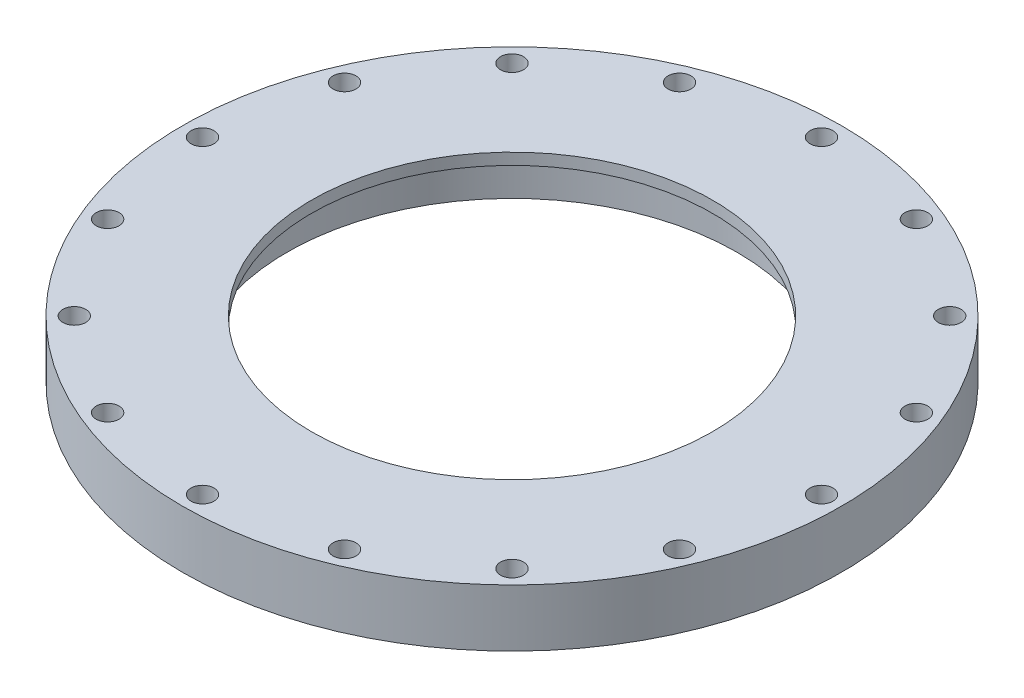
from build123d import *

# Parameters (mm, degrees)
SKETCH1_R           = 57.5
SKETCH1_R_2         = 39.25
BOSS_EXTRUDE1_DEPTH = 8
SKETCH3_R           = 57.5
SKETCH3_R_2         = 35
BOSS_EXTRUDE2_DEPTH = 2
SKETCH2_R           = 2
CUT_EXTRUDE1_DEPTH  = 25


with BuildPart() as part:
    # Sketch1 → Boss-Extrude1 (new body)
    with BuildSketch(Plane(origin=(0, 0, 0), x_dir=(1, 0, 0), z_dir=(0, 1, 0))):
        with Locations(Location((0, 0, 0), (0, 0, 270))):
            Circle(SKETCH1_R)
        with Locations(Location((0, 0, 0), (0, 0, 270))):
            Circle(SKETCH1_R_2, mode=Mode.SUBTRACT)
    extrude(amount=BOSS_EXTRUDE1_DEPTH)

    # Sketch3 → Boss-Extrude2 (add)
    with BuildSketch(Plane(origin=(0, 8, 0), x_dir=(1, 0, 0), z_dir=(0, 1, 0))):
        with Locations(Location((0, 0, 0), (0, 0, 270))):
            Circle(SKETCH3_R)
        with Locations(Location((0, 0, 0), (0, 0, 270))):
            Circle(SKETCH3_R_2, mode=Mode.SUBTRACT)
    extrude(amount=BOSS_EXTRUDE2_DEPTH)

    # Sketch2 → Cut-Extrude1 (cut)
    with BuildSketch(Plane(origin=(0, 10, 0), x_dir=(1, 0, 0), z_dir=(0, 1, 0))):
        with Locations(Location((0, 54, 0), (0, 0, 270))):
            Circle(SKETCH2_R)
        with Locations(Location((20.664905348, 49.889494756, 0), (0, 0, 270))):
            Circle(SKETCH2_R)
        with Locations(Location((38.183766184, 38.183766184, 0), (0, 0, 270))):
            Circle(SKETCH2_R)
        with Locations(Location((49.889494756, 20.664905348, 0), (0, 0, 270))):
            Circle(SKETCH2_R)
        with Locations(Location((54, 0, 0), (0, 0, 270))):
            Circle(SKETCH2_R)
        with Locations(Location((49.889494756, -20.664905348, 0), (0, 0, 270))):
            Circle(SKETCH2_R)
        with Locations(Location((38.183766184, -38.183766184, 0), (0, 0, 270))):
            Circle(SKETCH2_R)
        with Locations(Location((20.664905348, -49.889494756, 0), (0, 0, 270))):
            Circle(SKETCH2_R)
        with Locations(Location((0, -54, 0), (0, 0, 270))):
            Circle(SKETCH2_R)
        with Locations(Location((-20.664905348, -49.889494756, 0), (0, 0, 270))):
            Circle(SKETCH2_R)
        with Locations(Location((-38.183766184, -38.183766184, 0), (0, 0, 270))):
            Circle(SKETCH2_R)
        with Locations(Location((-49.889494756, -20.664905348, 0), (0, 0, 270))):
            Circle(SKETCH2_R)
        with Locations(Location((-54, 0, 0), (0, 0, 270))):
            Circle(SKETCH2_R)
        with Locations(Location((-49.889494756, 20.664905348, 0), (0, 0, 270))):
            Circle(SKETCH2_R)
        with Locations(Location((-38.183766184, 38.183766184, 0), (0, 0, 270))):
            Circle(SKETCH2_R)
        with Locations(Location((-20.664905348, 49.889494756, 0), (0, 0, 270))):
            Circle(SKETCH2_R)
    extrude(amount=-CUT_EXTRUDE1_DEPTH, mode=Mode.SUBTRACT)


solid = part.part
